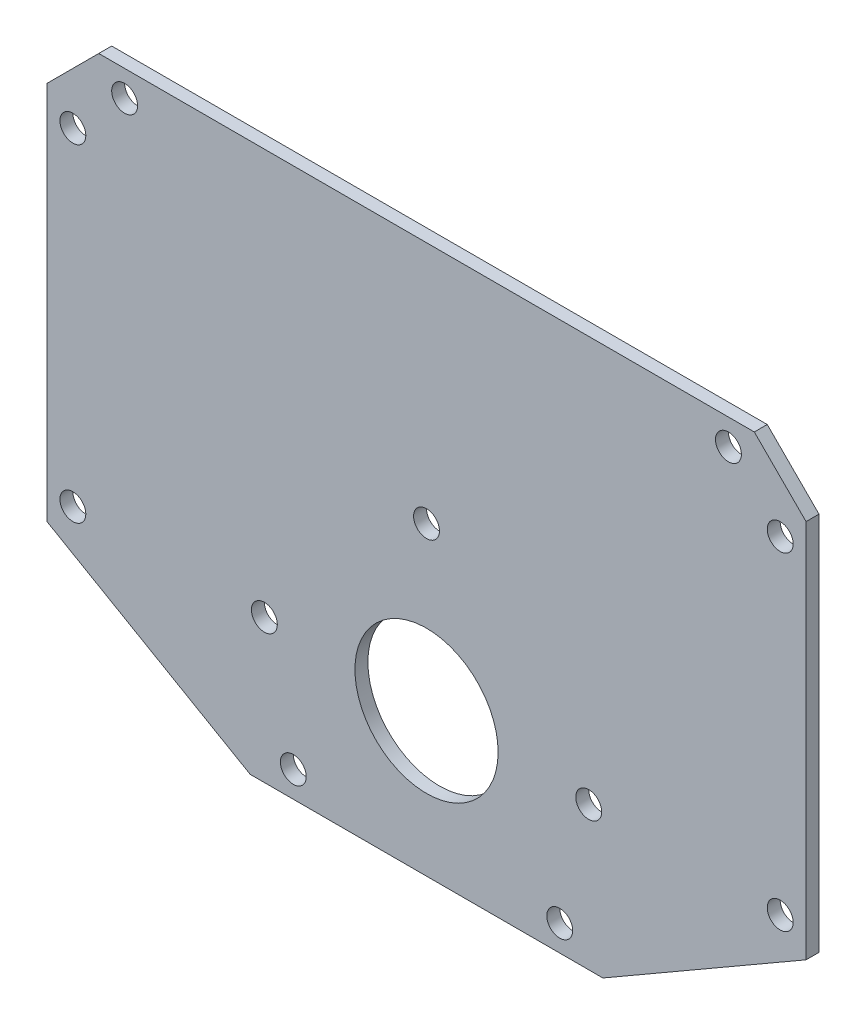
from build123d import *

# Parameters (mm, degrees)
SKETCH_1_R          = 1.5
EXTRUDE_1_DEPTH     = 1.5
SKETCH_2_R          = 1.5
SKETCH_2_R_2        = 8.3
CUT_EXTRUDE_1_DEPTH = 10


with BuildPart() as part:
    # 草图1 → 凸台-拉伸1 (new body)
    with BuildSketch(Plane.XY):
        Polygon((-44, -22), (-20.444109017, -35.6), (20.444109017, -35.6), (44, -22), (44, 22), (38, 28), (-38, 28), (-44, 22), align=None)
        with Locations((-41, 19)):
            Circle(SKETCH_1_R, mode=Mode.SUBTRACT)
        with Locations((-41, -19)):
            Circle(SKETCH_1_R, mode=Mode.SUBTRACT)
        with Locations((41, 19)):
            Circle(SKETCH_1_R, mode=Mode.SUBTRACT)
        with Locations((41, -19)):
            Circle(SKETCH_1_R, mode=Mode.SUBTRACT)
    extrude(amount=EXTRUDE_1_DEPTH)

    # 草图2 → 切除-拉伸1 (cut)
    with BuildSketch(Plane.XY.offset(1.5)):
        with Locations((0, -0.2)):
            Circle(SKETCH_2_R)
        with Locations((-18.8, -19)):
            Circle(SKETCH_2_R)
        with Locations((18.8, -19)):
            Circle(SKETCH_2_R)
        with Locations((0, -19)):
            Circle(SKETCH_2_R_2)
        with Locations((-15.444109017, -32.6)):
            Circle(SKETCH_2_R)
        with Locations((15.444109017, -32.6)):
            Circle(SKETCH_2_R)
        with Locations((-35, 25)):
            Circle(SKETCH_2_R)
        with Locations((35, 25)):
            Circle(SKETCH_2_R)
    extrude(amount=-CUT_EXTRUDE_1_DEPTH, mode=Mode.SUBTRACT)


solid = part.part
